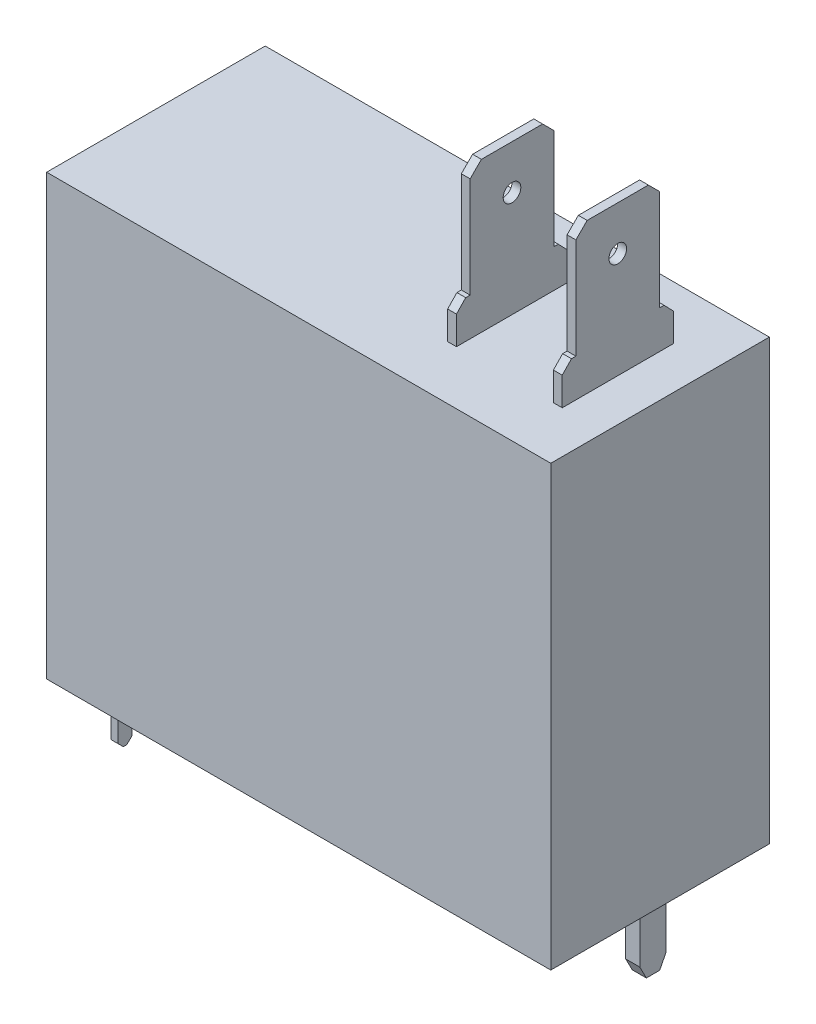
from build123d import *

# Parameters (mm, degrees)
CROQUIS1_W              = 28.6
CROQUIS1_H              = 12.4
SALIENTE_EXTRUIR1_DEPTH = 24.9
CROQUIS2_R              = 0.5
SALIENTE_EXTRUIR2_DEPTH = 0.25
SALIENTE_EXTRUIR3_DEPTH = 0.4
SALIENTE_EXTRUIR4_DEPTH = 0.2


with BuildPart() as part:
    # Croquis1 → Saliente-Extruir1 (new body)
    with BuildSketch(Plane(origin=(0, 0, 0), x_dir=(1, 0, 0), z_dir=(0, 1, 0))):
        with Locations((14.3, 6.2)):
            Rectangle(CROQUIS1_W, CROQUIS1_H)
    extrude(amount=SALIENTE_EXTRUIR1_DEPTH)

    # Croquis2 → Saliente-Extruir2 (add, symmetric)
    with BuildSketch(Plane(origin=(25.95, 0, 0), x_dir=(0, 0, -1), z_dir=(1, 0, 0))):
        Polygon((3.05, 24.9), (3.05, 26.504259841), (3.5733005, 27.05), (3.825, 27.05), (3.825, 32.761976859), (4.463023141, 33.4), (7.936976859, 33.4), (8.575, 32.761976859), (8.575, 27.05), (8.8266995, 27.05), (9.35, 26.504259841), (9.35, 24.9), align=None)
        with Locations((6.2, 30.9)):
            Circle(CROQUIS2_R, mode=Mode.SUBTRACT)
    saliente_extruir2 = extrude(amount=SALIENTE_EXTRUIR2_DEPTH, both=True)

    # Simetría1: Saliente-Extruir2 across plane
    add(saliente_extruir2.mirror(Plane(origin=(22.95, 0, 0), x_dir=(0, 0, 1), z_dir=(1, 0, 0))))

    # Croquis4 → Saliente-Extruir3 (add, symmetric)
    with BuildSketch(Plane.ZY.offset(-27.8)):
        Polygon((-6.95, 0), (-6.95, -2.77742352), (-6.577466383, -3.5), (-5.822533617, -3.5), (-5.45, -2.77742352), (-5.45, 0), align=None)
    extrude(amount=SALIENTE_EXTRUIR3_DEPTH, both=True)

    # Croquis6 → Saliente-Extruir4 (add, symmetric)
    with BuildSketch(Plane.ZY.offset(-1.8)):
        Polygon((-10.35, 0), (-10.35, -3.200399192), (-10.050399192, -3.5), (-9.849600808, -3.5), (-9.55, -3.200399192), (-9.55, 0), align=None)
        Polygon((-2.85, 0), (-2.05, 0), (-2.05, -3.200399192), (-2.349600808, -3.5), (-2.550399192, -3.5), (-2.85, -3.200399192), align=None)
    extrude(amount=SALIENTE_EXTRUIR4_DEPTH, both=True)


solid = part.part
